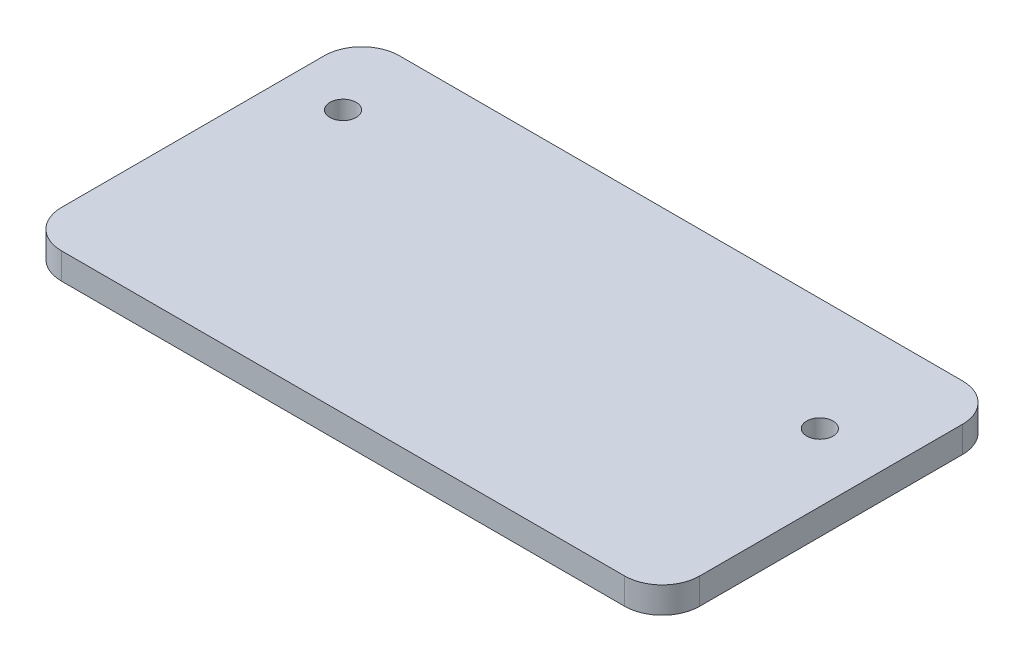
from build123d import *

# Parameters (mm, degrees)
CROQUIS1_R              = 1.75
SALIENTE_EXTRUIR1_DEPTH = 3.5


with BuildPart() as part:
    # Croquis1 → Saliente-Extruir1 (new body)
    with BuildSketch(Plane(origin=(0, 0, 0), x_dir=(1, 0, 0), z_dir=(0, 1, 0))):
        with BuildLine():
            Line((-37.5, 22.5), (37.5, 22.5))
            ThreePointArc((37.5, 22.5), (41.035533906, 21.035533906), (42.5, 17.5))
            Line((42.5, 17.5), (42.5, -17.5))
            ThreePointArc((42.5, -17.5), (41.035533906, -21.035533906), (37.5, -22.5))
            Line((37.5, -22.5), (-37.5, -22.5))
            ThreePointArc((-37.5, -22.5), (-41.035533906, -21.035533906), (-42.5, -17.5))
            Line((-42.5, -17.5), (-42.5, 17.5))
            ThreePointArc((-42.5, 17.5), (-41.035533906, 21.035533906), (-37.5, 22.5))
        make_face()
        with Locations(Location((-35, 12.5, 0), (0, 0, 270))):
            Circle(CROQUIS1_R, mode=Mode.SUBTRACT)
        with Locations(Location((33.5, 7.5, 0), (0, 0, 270))):
            Circle(CROQUIS1_R, mode=Mode.SUBTRACT)
    extrude(amount=SALIENTE_EXTRUIR1_DEPTH)


solid = part.part
